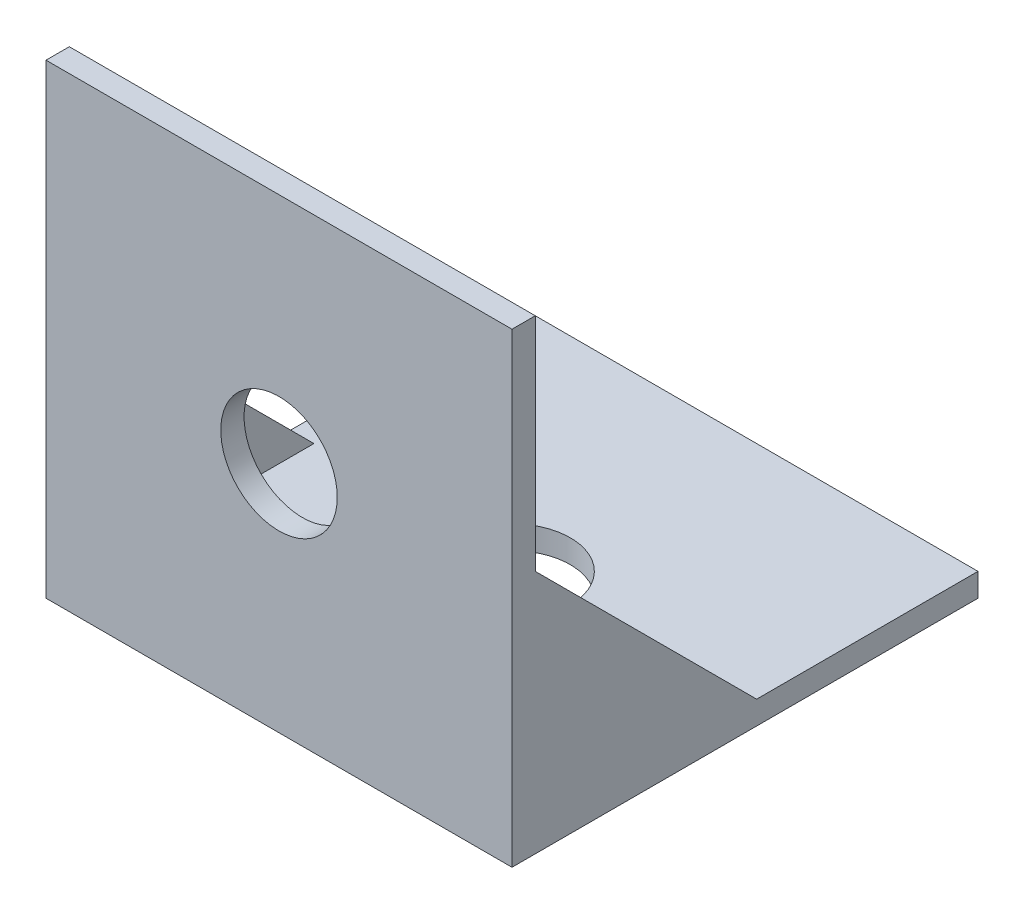
from build123d import *

# Parameters (mm, degrees)
SKETCH1_W           = 20
SKETCH1_H           = 20
SKETCH1_R           = 2.5
BOSS_EXTRUDE1_DEPTH = 1
SKETCH2_W           = 20
SKETCH2_H           = 20
SKETCH2_R           = 2.5
BOSS_EXTRUDE2_DEPTH = 1
BOSS_EXTRUDE3_DEPTH = 1
BOSS_EXTRUDE4_START = -19
BOSS_EXTRUDE4_DEPTH = 1


with BuildPart() as part:
    # Sketch1 → Boss-Extrude1 (new body)
    with BuildSketch(Plane(origin=(0, 0, 0), x_dir=(1, 0, 0), z_dir=(0, 1, 0))):
        Rectangle(SKETCH1_W, SKETCH1_H)
        Circle(SKETCH1_R, mode=Mode.SUBTRACT)
    extrude(amount=BOSS_EXTRUDE1_DEPTH)

    # Sketch2 → Boss-Extrude2 (add)
    with BuildSketch(Plane.XY.offset(10)):
        with Locations((0, 10)):
            Rectangle(SKETCH2_W, SKETCH2_H)
        with Locations((0, 10)):
            Circle(SKETCH2_R, mode=Mode.SUBTRACT)
    extrude(amount=-BOSS_EXTRUDE2_DEPTH)

    # Sketch3 → Boss-Extrude3 (add)
    with BuildSketch(Plane(origin=(10, 0, 0), x_dir=(0, 0, -1), z_dir=(1, 0, 0))):
        Polygon((-9, 10.5), (0.5, 1), (-9, 1), align=None)
    extrude(amount=-BOSS_EXTRUDE3_DEPTH)

    # Sketch3<2> → Boss-Extrude4 (add)
    with BuildSketch(Plane(origin=(10, 0, 0), x_dir=(0, 0, -1), z_dir=(1, 0, 0)).offset(BOSS_EXTRUDE4_START)):
        Polygon((-9, 10.5), (0.5, 1), (-9, 1), align=None)
    extrude(amount=-BOSS_EXTRUDE4_DEPTH)


solid = part.part
